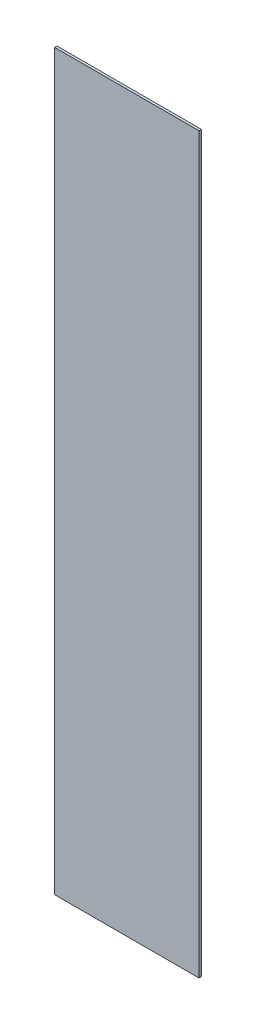
from build123d import *

# Parameters (mm, degrees)
SKETCH1_W           = 120
SKETCH1_H           = 610
BOSS_EXTRUDE1_DEPTH = 2


with BuildPart() as part:
    # Sketch1 → Boss-Extrude1 (new body)
    with BuildSketch(Plane.XY):
        Rectangle(SKETCH1_W, SKETCH1_H)
    extrude(amount=BOSS_EXTRUDE1_DEPTH)


solid = part.part
